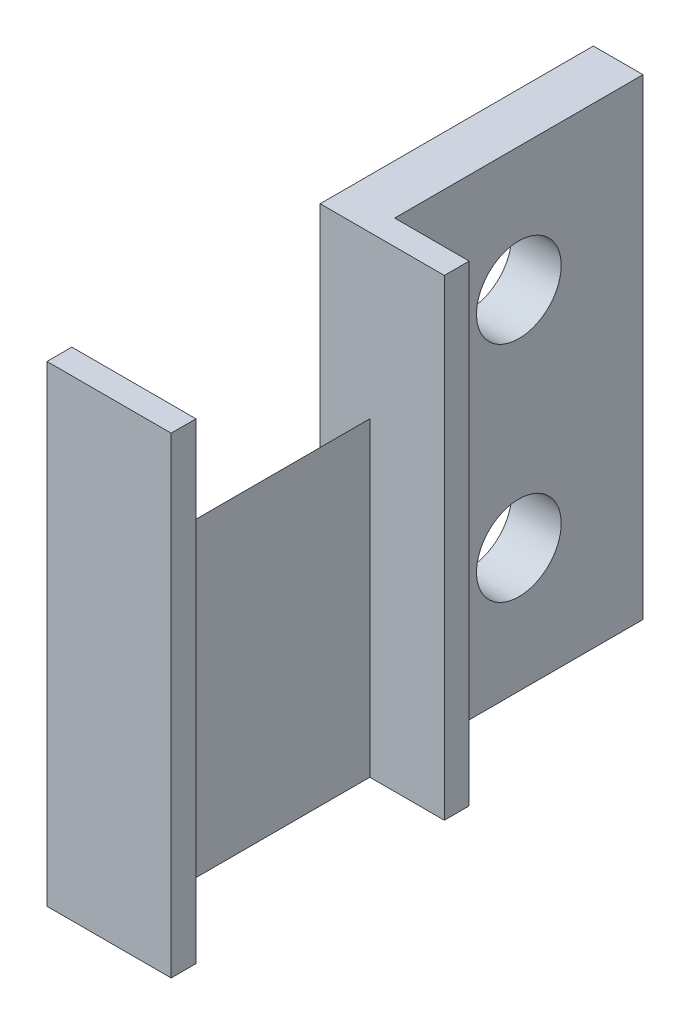
from build123d import *

# Parameters (mm, degrees)
BOSS_EXTRUDE1_DEPTH = 10
SKETCH2_W           = 10
SKETCH2_H           = 2
BOSS_EXTRUDE2_DEPTH = 38
SKETCH4_W           = 4
SKETCH4_H           = 38
BOSS_EXTRUDE3_DEPTH = 20
CUT_EXTRUDE1_REACH  = 43.355
SKETCH3_R           = 3.41


with BuildPart() as part:
    # Sketch1 → Boss-Extrude1 (new, symmetric)
    with BuildSketch(Plane.XY):
        Polygon((-2, 5), (2, 12.5), (2, -12.5), (-2, -12.5), align=None)
    extrude(amount=BOSS_EXTRUDE1_DEPTH, both=True)

    # Sketch2 → Boss-Extrude2 (add)
    with BuildSketch(Plane.XZ.offset(12.5)):
        with Locations((3, 11)):
            Rectangle(SKETCH2_W, SKETCH2_H)
        with Locations((3, -11)):
            Rectangle(SKETCH2_W, SKETCH2_H)
    extrude(amount=-BOSS_EXTRUDE2_DEPTH)

    # Sketch4 → Boss-Extrude3 (add)
    with BuildSketch(Plane(origin=(0, 0, -12), x_dir=(-1, 0, 0), z_dir=(0, 0, -1))):
        with Locations((0, 6.5)):
            Rectangle(SKETCH4_W, SKETCH4_H)
    extrude(amount=BOSS_EXTRUDE3_DEPTH)

    # Sketch3 → Cut-Extrude1 (cut, up to next)
    with BuildSketch(Plane(origin=(2, 0, 0), x_dir=(0, 0, -1), z_dir=(1, 0, 0)), mode=Mode.PRIVATE) as cut_extrude1_sk1:
        with Locations((22, -2.5)):
            Circle(SKETCH3_R)
    cut_extrude1_tool1 = extrude(cut_extrude1_sk1.sketch, amount=-CUT_EXTRUDE1_REACH, mode=Mode.PRIVATE) & part.part
    # Sketch3 → Cut-Extrude1 (cut, up to next)
    with BuildSketch(Plane(origin=(2, 0, 0), x_dir=(0, 0, -1), z_dir=(1, 0, 0)), mode=Mode.PRIVATE) as cut_extrude1_sk2:
        with Locations((22, 15.5)):
            Circle(SKETCH3_R)
    cut_extrude1_tool2 = extrude(cut_extrude1_sk2.sketch, amount=-CUT_EXTRUDE1_REACH, mode=Mode.PRIVATE) & part.part
    add(cut_extrude1_tool1.solids().sort_by_distance((2, -2.5, -22))[0], mode=Mode.SUBTRACT)
    add(cut_extrude1_tool2.solids().sort_by_distance((2, 15.5, -22))[0], mode=Mode.SUBTRACT)


solid = part.part
